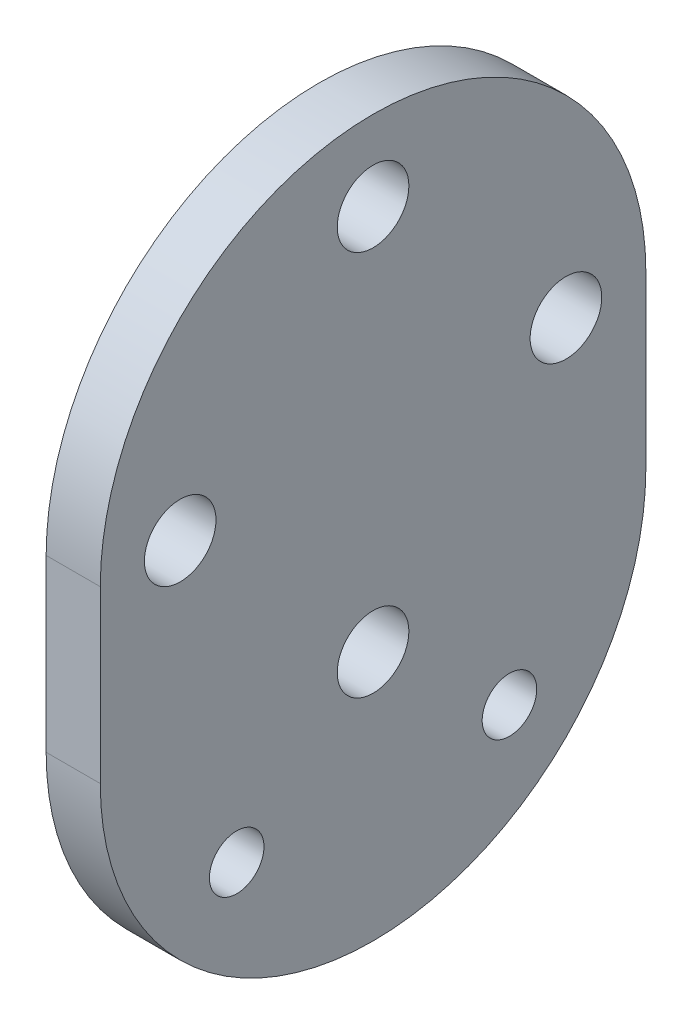
from build123d import *

# Parameters (mm, degrees)
SKETCH2_R           = 1.6
SKETCH2_R_2         = 2.1
BOSS_EXTRUDE1_DEPTH = 3.175


with BuildPart() as part:
    # Sketch2 → Boss-Extrude1 (new body)
    with BuildSketch(Plane(origin=(0, 0, 0), x_dir=(0, 0, -1), z_dir=(1, 0, 0))):
        with BuildLine():
            Line((-16, 5), (-16, -5))
            ThreePointArc((-16, -5), (0, -21), (16, -5))
            Line((16, -5), (16, 5))
            ThreePointArc((16, 5), (0, 21), (-16, 5))
        make_face()
        with Locations((-8, -13)):
            Circle(SKETCH2_R, mode=Mode.SUBTRACT)
        with Locations((0, -6.313708499)):
            Circle(SKETCH2_R_2, mode=Mode.SUBTRACT)
        with Locations((8, -13)):
            Circle(SKETCH2_R, mode=Mode.SUBTRACT)
        with Locations((-11.313708499, 5)):
            Circle(SKETCH2_R_2, mode=Mode.SUBTRACT)
        with Locations((0, 16.313708499)):
            Circle(SKETCH2_R_2, mode=Mode.SUBTRACT)
        with Locations((11.313708499, 5)):
            Circle(SKETCH2_R_2, mode=Mode.SUBTRACT)
    extrude(amount=BOSS_EXTRUDE1_DEPTH)


solid = part.part
